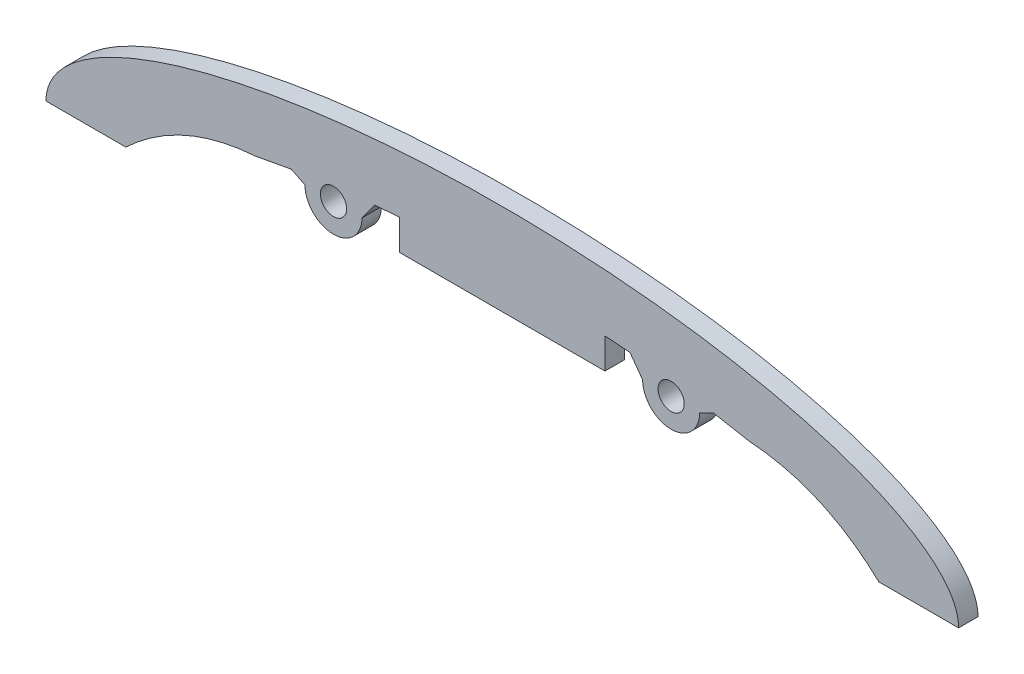
from build123d import *

# Parameters (mm, degrees)
DODANIE_WYCI_GNI_CIE1_DEPTH = 1.7
SZKIC2_R                    = 1.15
WYTNIJ_WYCI_GNI_CIE1_DEPTH  = 42.795813316


with BuildPart() as part:
    # Szkic1 → Dodanie-wyciągnięcie1 (new body)
    with BuildSketch(Plane.XY):
        with BuildLine():
            add(Edge.make_bspline(
                [(21.610248783, 5), (21.218014803, 5.080669051), (20.439497964, 5.234369435), (19.495106089, 5.4060474), (18.742029281, 5.535289477), (17.911990644, 5.672615797), (15.626961668, 6.023025368), (13.094773789, 6.327363611), (10.837187067, 6.533647254), (10.105390687, 6.595203086), (9.370277357, 6.653515829), (7.931145165, 6.757430596), (4.768476681, 6.935815197), (0, 7.043570361), (-4.768476681, 6.935815197), (-7.931145165, 6.757430596), (-9.370277357, 6.653515829), (-10.105390687, 6.595203086), (-10.837187067, 6.533647254), (-13.094773789, 6.327363611), (-15.626961668, 6.023025368), (-17.911990644, 5.672615797), (-18.742029281, 5.535289477), (-19.495106089, 5.4060474), (-20.439497964, 5.234369435), (-21.218014803, 5.080669051), (-21.610248783, 5)],
                knots=[-2.171759775, -2.171759775, -2.171759775, -2.171759775, -2.134199559, -2.096639344, -2.084152741, -2.065372634, -2.021518913, -1.881327865, -1.851592123, -1.836724252, -1.821856381, -1.79212064, -1.721037189, -1.570796327, -1.420555465, -1.349472014, -1.319736272, -1.304868401, -1.290000531, -1.260264789, -1.120073741, -1.07622002, -1.057439912, -1.04495331, -1.007393094, -0.969832879, -0.969832879, -0.969832879, -0.969832879], degree=3))
            add(Edge.make_bspline(
                [(-21.610248783, 5), (-28.203420875, 4.53862996), (-33, 0)],
                knots=[0, 0, 0, 1, 1, 1], degree=2))
            Line((-33, 0), (-40, 0))
            add(Edge.make_bspline(
                [(40, 0), (40, 12), (0, 12), (-40, 12), (-40, 0)],
                knots=[3.141592654, 3.141592654, 3.141592654, 4.71238898, 4.71238898, 6.283185307, 6.283185307, 6.283185307], degree=2, weights=[1, 0.707106781, 1, 0.707106781, 1]))
            Line((40, 0), (33, 0))
            add(Edge.make_bspline(
                [(21.610248783, 5), (28.203420875, 4.53862996), (33, 0)],
                knots=[0, 0, 0, 1, 1, 1], degree=2))
        make_face()
        with BuildLine():
            add(Edge.make_bspline(
                [(-11.2, 6.500052475), (-11.381613586, 6.483457098), (-13.27088078, 6.306197689), (-15.626961668, 6.023025368), (-17.806202115, 5.688838486), (-18.396244777, 5.592306202), (-18.5, 5.575141027)],
                knots=[-1.27513266, -1.27513266, -1.27513266, -1.27513266, -1.260264789, -1.120073741, -1.07622002, -1.066829966, -1.066829966, -1.066829966, -1.066829966], degree=3))
            Line((-18.5, 5.575141027), (-17.3, 4.979816))
            ThreePointArc((-17.3, 4.979816), (-14.8, 2.479816), (-12.3, 4.979816))
            Line((-12.3, 4.979816), (-11.2, 6.500052475))
        make_face()
        with BuildLine():
            add(Edge.make_bspline(
                [(9, 6.679816), (8.815069068, 6.693169007), (7.743850748, 6.767994599), (4.768476681, 6.935815197), (0, 7.043570361), (-4.768476681, 6.935815197), (-7.743850748, 6.767994599), (-8.815069068, 6.693169007), (-9, 6.679816)],
                knots=[-1.80698851, -1.80698851, -1.80698851, -1.80698851, -1.79212064, -1.721037189, -1.570796327, -1.420555465, -1.349472014, -1.334604143, -1.334604143, -1.334604143, -1.334604143], degree=3))
            Line((-9, 6.679816), (-9, 4))
            Line((-9, 4), (9, 4))
            Line((9, 4), (9, 6.679816))
        make_face()
        with BuildLine():
            Line((17.3, 4.979816), (18.5, 5.575141027))
            add(Edge.make_bspline(
                [(18.5, 5.575141027), (18.396244777, 5.592306202), (17.806202115, 5.688838486), (15.626961668, 6.023025368), (13.27088078, 6.306197689), (11.381613586, 6.483457098), (11.2, 6.500052475)],
                knots=[-2.074762688, -2.074762688, -2.074762688, -2.074762688, -2.065372634, -2.021518913, -1.881327865, -1.866459994, -1.866459994, -1.866459994, -1.866459994], degree=3))
            Line((11.2, 6.500052475), (12.3, 4.979816))
            ThreePointArc((12.3, 4.979816), (14.8, 2.479816), (17.3, 4.979816))
        make_face()
    extrude(amount=DODANIE_WYCI_GNI_CIE1_DEPTH)

    # Szkic2 → Wytnij-wyciągnięcie1 (cut, through all)
    with BuildSketch(Plane.XY.offset(1.7)):
        with Locations((-14.8, 4.979816)):
            Circle(SZKIC2_R)
        with Locations((14.8, 4.979816)):
            Circle(SZKIC2_R)
    extrude(amount=-WYTNIJ_WYCI_GNI_CIE1_DEPTH, mode=Mode.SUBTRACT)


solid = part.part
